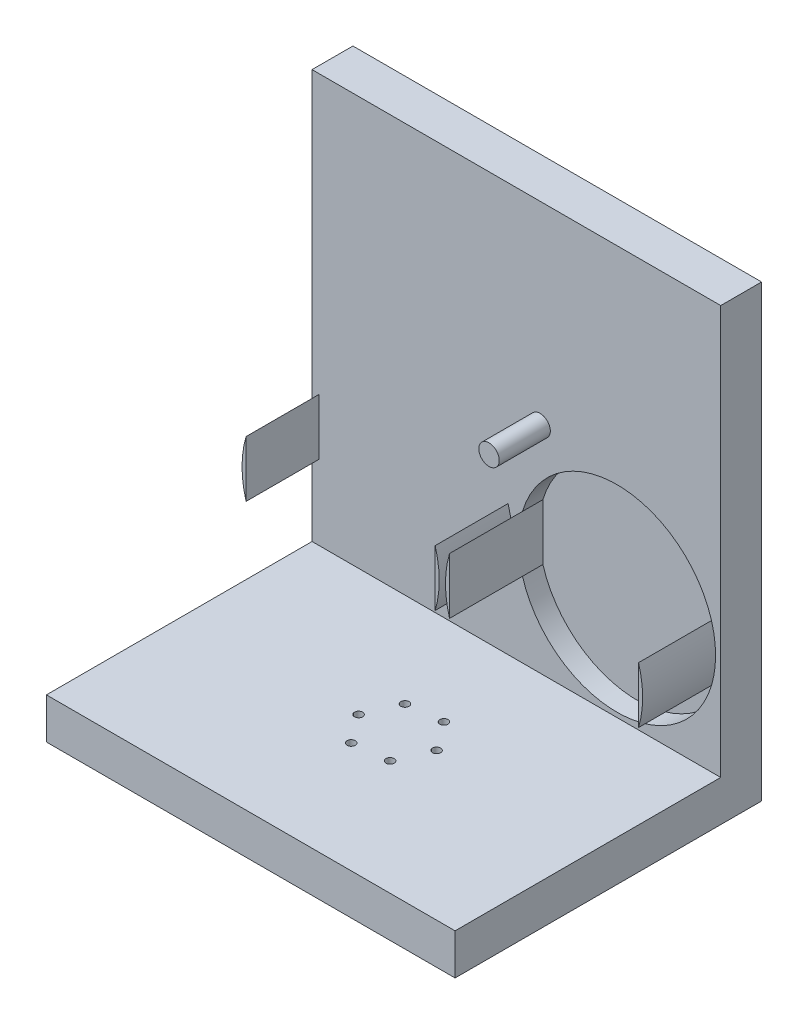
from build123d import *

# Parameters (mm, degrees)
SKETCH_1_W          = 200
SKETCH_1_H          = 200
EXTRUDE_2_DEPTH     = 20
EXTRUDE_5_DEPTH     = 35.7
EXTRUDE_7_DEPTH     = 35.7
SKETCH_16_W         = 200
SKETCH_16_H         = 20
EXTRUDE_9_DEPTH     = 130
SKETCH_17_W         = 20
SKETCH_17_H         = 19.997799489
EXTRUDE_10_DEPTH    = 200
SKETCH_18_R         = 2
CUT_EXTRUDE_3_DEPTH = 20
CUT_EXTRUDE_START   = -10
CUT_EXTRUDE_4_DEPTH = 10
SKETCH_20_R         = 5
EXTRUDE_11_DEPTH    = 25


with BuildPart() as part:
    # 草图1 → 凸台-拉伸2 (new body)
    with BuildSketch(Plane.XY):
        with Locations((-1.837901133, -0.53181486)):
            Rectangle(SKETCH_1_W, SKETCH_1_H)
    extrude(amount=EXTRUDE_2_DEPTH)

    # 草图7 → 凸台-拉伸5 (add)
    with BuildSketch(Plane.XY.offset(20)):
        with BuildLine():
            Line((1.147412205, -36.2889375), (1.147412205, -63.78439167))
            ThreePointArc((1.147412205, -63.78439167), (-0.852587795, -50.036664585), (1.147412205, -36.2889375))
        make_face()
        with BuildLine():
            Line((93.647412205, -36.2889375), (93.647412205, -63.78439167))
            ThreePointArc((93.647412205, -63.78439167), (95.647412205, -50.036664585), (93.647412205, -36.2889375))
        make_face()
    extrude(amount=EXTRUDE_5_DEPTH)

    # 草图11 → 凸台-拉伸7 (add)
    with BuildSketch(Plane.XY.offset(20)):
        with BuildLine():
            Line((-98.401360019, -36.468628425), (-98.401360019, -63.964082595))
            ThreePointArc((-98.401360019, -63.964082595), (-100.401360019, -50.21635551), (-98.401360019, -36.468628425))
        make_face()
        with BuildLine():
            Line((-5.901360019, -36.468628425), (-5.901360019, -63.964082595))
            ThreePointArc((-5.901360019, -63.964082595), (-3.901360019, -50.21635551), (-5.901360019, -36.468628425))
        make_face()
    extrude(amount=EXTRUDE_7_DEPTH)



with BuildPart() as body_2:
    # 草图16 → 凸台-拉伸9 (new body)
    with BuildSketch(Plane.XY.offset(20)):
        with Locations((-1.837901133, -110.53181486)):
            Rectangle(SKETCH_16_W, SKETCH_16_H)
    extrude(amount=EXTRUDE_9_DEPTH)


with BuildPart() as part_1:
    add(part.part)

    add(body_2.part)  # 凸台-拉伸10 merges body 2
    # 草图17 → 凸台-拉伸10 (add)
    with BuildSketch(Plane(origin=(98.162098867, 0, 0), x_dir=(0, 0, -1), z_dir=(1, 0, 0))):
        with Locations((-10, -110.530714605)):
            Rectangle(SKETCH_17_W, SKETCH_17_H)
    extrude(amount=-EXTRUDE_10_DEPTH)

    # 草图18 → 切除-拉伸3 (cut)
    with BuildSketch(Plane(origin=(0, -100.53181486, 0), x_dir=(1, 0, 0), z_dir=(0, 1, 0))):
        with Locations(Location((-17.139851229, -81.946278464, 0), (0, 0, 270))):
            Circle(SKETCH_18_R)
        with Locations(Location((-10.255452207, -66.129592651, 0), (0, 0, 270))):
            Circle(SKETCH_18_R)
        with Locations(Location((6.884399022, -64.183314187, 0), (0, 0, 270))):
            Circle(SKETCH_18_R)
        with Locations(Location((17.139851229, -78.053721536, 0), (0, 0, 270))):
            Circle(SKETCH_18_R)
        with Locations(Location((10.255452207, -93.870407349, 0), (0, 0, 270))):
            Circle(SKETCH_18_R)
        with Locations(Location((-6.884399022, -95.816685813, 0), (0, 0, 270))):
            Circle(SKETCH_18_R)
    extrude(amount=-CUT_EXTRUDE_3_DEPTH, mode=Mode.SUBTRACT)

    # 草图14 → 切除-拉伸4 (cut)
    with BuildSketch(Plane.XY.offset(20).offset(CUT_EXTRUDE_START)):
        with BuildLine():
            Line((1.147412205, -36.2889375), (1.147412205, -63.78439167))
            ThreePointArc((1.147412205, -63.78439167), (47.397412205, -98.286664585), (93.647412205, -63.78439167))
            Line((93.647412205, -63.78439167), (93.647412205, -36.2889375))
            ThreePointArc((93.647412205, -36.2889375), (47.397412205, -1.786664585), (1.147412205, -36.2889375))
        make_face()
    extrude(amount=CUT_EXTRUDE_4_DEPTH, mode=Mode.SUBTRACT)

    # 草图20 → 凸台-拉伸11 (add)
    with BuildSketch(Plane.XY.offset(20)):
        with Locations((9.771333485, 4.580206065)):
            Circle(SKETCH_20_R)
    extrude(amount=EXTRUDE_11_DEPTH)


solid = part_1.part
